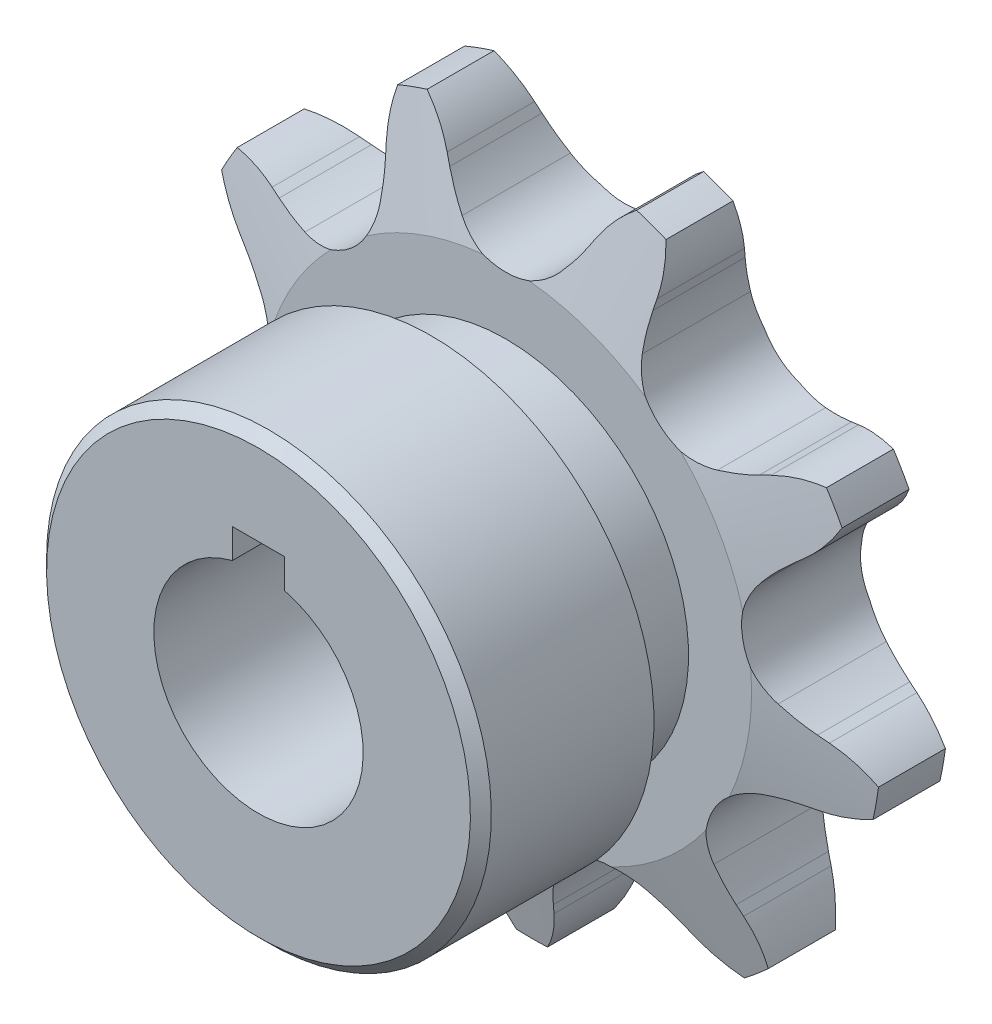
from build123d import *

# Parameters (mm, degrees)
CUT_EXTRUDE1_DEPTH        = 31.276806757
CIRPATTERN1_COUNT         = 9
BORE_OD_HUBDIAMETER_START = 3.6068
SKETCH2_R                 = 13.49375
BORE_OD_HUBDIAMETER_DEPTH = 15.0114
CUT_EXTRUDE2_DEPTH        = 36.249895803
CUT_EXTRUDE2_DEPTH_BACK   = 36.249895803
SKETCH3_OUTSIDE_W         = 56.786
SKETCH3_OUTSIDE_H         = 56.165
SKETCH3_OUTSIDE_R         = 21.209
SKETCH3_OUTSIDE_R_2       = 6.35
SKETCH4_W                 = 4.5085
SKETCH4_H                 = 10.175
SKETCH5_W                 = 3.175
SKETCH5_H                 = 3.175
KEYWAY_DEPTH              = 38.229821554


with BuildPart() as part:
    # Sketch1 → Revolve1 (revolve)
    with BuildSketch(Plane(origin=(0, 0, 0), x_dir=(0, 0, -1), z_dir=(1, 0, 0)), mode=Mode.PRIVATE) as revolve1_sk:
        Polygon((3.6068, 0), (-3.6068, 0), (-3.6068, 14.906481614), (-2.0193, 21.256481614), (2.0193, 21.256481614), (3.6068, 14.906481614), align=None)
    revolve(revolve1_sk.sketch.rotate(Axis((0, 0, -3.6068), (0, 0, 1)), 90), axis=Axis((0, 0, -3.6068), (0, 0, 1)))

    # Sketch0 → Cut-Extrude1 (cut, symmetric)
    with BuildSketch(Plane.XY):
        with BuildLine():
            Line((10.459820372, -15.525258067), (9.992284625, -15.131401427))
            ThreePointArc((9.992284625, -15.131401427), (9.147117765, -14.490659508), (8.240671188, -13.940012769))
            ThreePointArc((8.240671188, -13.940012769), (4.987490251, -13.703016844), (2.647747116, -15.975670654))
            ThreePointArc((2.647747116, -15.975670654), (2.307317654, -16.980143157), (2.071743243, -18.014242729))
            Line((2.071743243, -18.014242729), (1.96675625, -18.616480605))
            ThreePointArc((1.96675625, -18.616480605), (-1.089427995, -23.195538185), (-6.532554527, -24.020404248))
            ThreePointArc((-6.532554527, -24.020404248), (8.513856865, -23.391629489), (20.444245325, -14.201652086))
            ThreePointArc((20.444245325, -14.201652086), (15.744354807, -17.068542315), (10.459820372, -15.525258067))
        make_face()
    cut_extrude1 = extrude(amount=CUT_EXTRUDE1_DEPTH, both=True, mode=Mode.SUBTRACT)

    # CirPattern1: Cut-Extrude1 ×9 about axis
    cirpattern1_axis = Axis((0, 0, 0), (0, 0, 1))
    for i in range(1, CIRPATTERN1_COUNT):
        add(cut_extrude1.rotate(cirpattern1_axis, i * 360 / CIRPATTERN1_COUNT), mode=Mode.SUBTRACT)

    # Sketch2 → Bore/OD/HubDiameter (add)
    with BuildSketch(Plane.XY.offset(BORE_OD_HUBDIAMETER_START)):
        with Locations(Location((0, 0, 0), (0, 0, 180))):
            Circle(SKETCH2_R)
    extrude(amount=BORE_OD_HUBDIAMETER_DEPTH)

    # Sketch3 outside → Cut-Extrude2 (cut, two sides: drawn at the far end of the back side and taken through both)
    # profile 1 of 2: a face of its own
    with BuildSketch(Plane.XY.offset(-CUT_EXTRUDE2_DEPTH_BACK)):
        with Locations((0, -0.4935)):
            Rectangle(SKETCH3_OUTSIDE_W, SKETCH3_OUTSIDE_H)
        Circle(SKETCH3_OUTSIDE_R, mode=Mode.SUBTRACT)
    # profile 2 of 2: a face of its own
    with BuildSketch(Plane.XY.offset(-CUT_EXTRUDE2_DEPTH_BACK)):
        Circle(SKETCH3_OUTSIDE_R_2)
    extrude(amount=CUT_EXTRUDE2_DEPTH + CUT_EXTRUDE2_DEPTH_BACK, mode=Mode.SUBTRACT)

    # Sketch4 → Cut-Revolve1 (revolve, cut)
    with BuildSketch(Plane(origin=(0, 0, 0), x_dir=(0, 0, -1), z_dir=(1, 0, 0))):
        Polygon((-18.6182, 13.49375), (-18.6182, 12.85875), (-17.9832, 13.49375), align=None)
        with Locations((-5.86105, 16.168981614)):
            Rectangle(SKETCH4_W, SKETCH4_H)
    revolve(axis=Axis((0, 0, -3.6068), (0, 0, 1)), mode=Mode.SUBTRACT)

    # Sketch5 → Keyway (cut, through all)
    with BuildSketch(Plane(origin=(0, 0, -3.6068), x_dir=(-1, 0, 0), z_dir=(0, 0, -1))):
        with Locations((0, 6.35)):
            Rectangle(SKETCH5_W, SKETCH5_H)
    extrude(amount=-KEYWAY_DEPTH, mode=Mode.SUBTRACT)


solid = part.part
